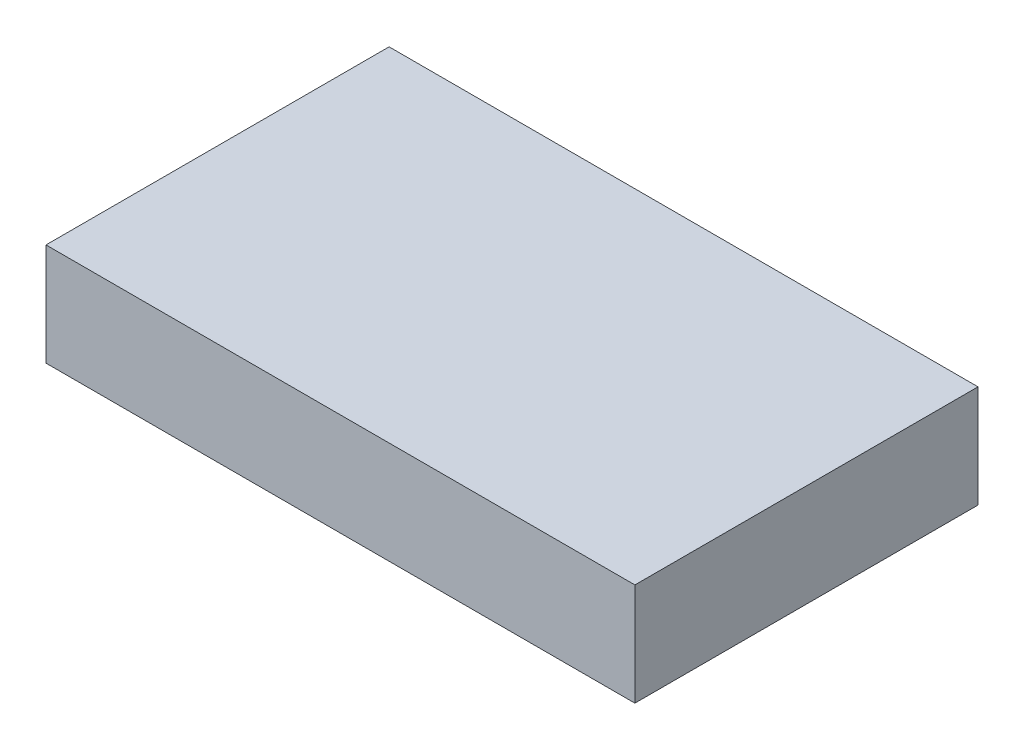
from build123d import *

# Parameters (mm, degrees)
SKETCH1_W           = 115
SKETCH1_H           = 67
BOSS_EXTRUDE1_DEPTH = 20


with BuildPart() as part:
    # Sketch1 → Boss-Extrude1 (new body)
    with BuildSketch(Plane(origin=(0, 0, 0), x_dir=(1, 0, 0), z_dir=(0, 1, 0))):
        Rectangle(SKETCH1_W, SKETCH1_H)
    extrude(amount=BOSS_EXTRUDE1_DEPTH)


solid = part.part
